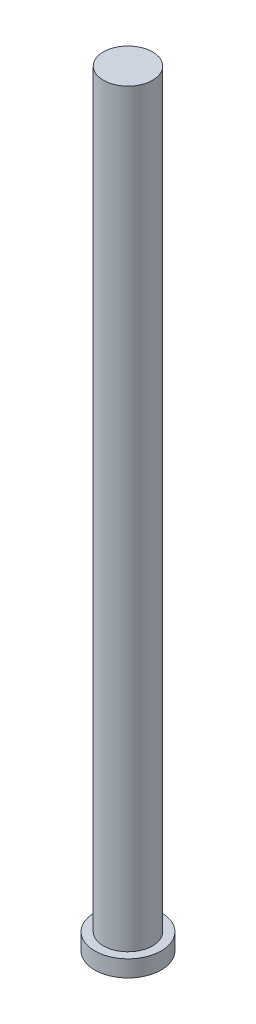
from build123d import *

# Parameters (mm, degrees)
SKETCH1_R                        = 6.35
BOSS_EXTRUDE1_DEPTH              = 3.175
SKETCH2_R                        = 4.699
BOSS_EXTRUDE2_DEPTH              = 143.256
F_97_0_0059_DIAMETER_HOLE1_D     = 6.35
F_97_0_0059_DIAMETER_HOLE1_DEPTH = 143.256


with BuildPart() as part:
    # Sketch1 → Boss-Extrude1 (new body)
    with BuildSketch(Plane(origin=(0, 0, 0), x_dir=(1, 0, 0), z_dir=(0, 1, 0))):
        with Locations(Location((0, 0, 0), (0, 0, 270))):
            Circle(SKETCH1_R)
    extrude(amount=-BOSS_EXTRUDE1_DEPTH)

    # Sketch2 → Boss-Extrude2 (add)
    with BuildSketch(Plane(origin=(0, 0, 0), x_dir=(1, 0, 0), z_dir=(0, 1, 0))):
        with Locations(Location((0, 0, 0), (0, 0, 270))):
            Circle(SKETCH2_R)
    extrude(amount=BOSS_EXTRUDE2_DEPTH)

    # #97 (0.0059) Diameter Hole1
    with Locations(Plane(origin=(0, -3.175, 0), x_dir=(0, 0, -1), z_dir=(0, -1, 0))):
        with Locations((0, 0)):
            Hole(F_97_0_0059_DIAMETER_HOLE1_D / 2, depth=F_97_0_0059_DIAMETER_HOLE1_DEPTH)


solid = part.part
